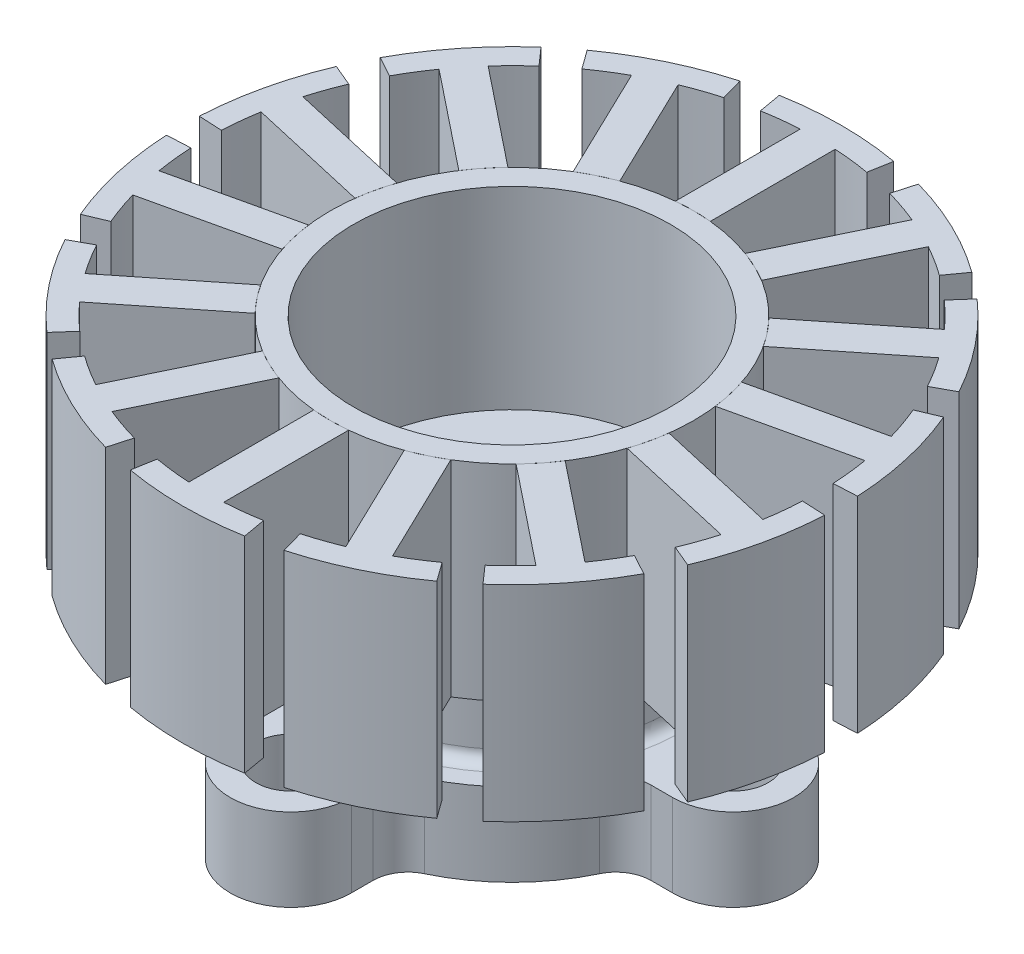
from build123d import *

# Parameters (mm, degrees)
SKETCH_1_R               = 1.5
SKETCH_1_R_2             = 6.25
EXTRUDE_1_DEPTH          = 3.55
FILLET_1_R               = 1.5
SKETCH_2_W               = 2
SKETCH_2_H               = 3.6
FILLET_2_R               = 0.5
SKETCH_4_W               = 1
SKETCH_4_H               = 8.82
EXTRUDE_2_DEPTH          = 8.82
PATTERN_CIRCULAR_1_COUNT = 14


with BuildPart() as part:
    # Эскиз1 → Бобышка-Вытянуть1 (new body)
    with BuildSketch(Plane(origin=(0, 0, 0), x_dir=(1, 0, 0), z_dir=(0, 1, 0))):
        with BuildLine():
            Line((-2.6, 9.5), (-2.6, 7.565712128))
            ThreePointArc((-2.6, 7.565712128), (-5.656854249, 5.656854249), (-7.565712128, 2.6))
            Line((-7.565712128, 2.6), (-9.5, 2.6))
            ThreePointArc((-9.5, 2.6), (-12.1, 0), (-9.5, -2.6))
            Line((-9.5, -2.6), (-7.565712128, -2.6))
            ThreePointArc((-7.565712128, -2.6), (-5.656854249, -5.656854249), (-2.6, -7.565712128))
            Line((-2.6, -7.565712128), (-2.6, -9.5))
            ThreePointArc((-2.6, -9.5), (0, -12.1), (2.6, -9.5))
            Line((2.6, -9.5), (2.6, -7.565712128))
            ThreePointArc((2.6, -7.565712128), (5.656854249, -5.656854249), (7.565712128, -2.6))
            Line((7.565712128, -2.6), (9.5, -2.6))
            ThreePointArc((9.5, -2.6), (12.1, 0), (9.5, 2.6))
            Line((9.5, 2.6), (7.565712128, 2.6))
            ThreePointArc((7.565712128, 2.6), (5.656854249, 5.656854249), (2.6, 7.565712128))
            Line((2.6, 7.565712128), (2.6, 9.5))
            ThreePointArc((2.6, 9.5), (0, 12.1), (-2.6, 9.5))
        make_face()
        with Locations(Location((0, 9.5, 0), (0, 0, 270))):
            Circle(SKETCH_1_R, mode=Mode.SUBTRACT)
        with Locations(Location((9.5, 0, 0), (0, 0, 270))):
            Circle(SKETCH_1_R, mode=Mode.SUBTRACT)
        with Locations(Location((-9.5, 0, 0), (0, 0, 270))):
            Circle(SKETCH_1_R, mode=Mode.SUBTRACT)
        with Locations(Location((0, -9.5, 0), (0, 0, 270))):
            Circle(SKETCH_1_R, mode=Mode.SUBTRACT)
        with Locations(Location((0, 0, 0), (0, 0, 270))):
            Circle(SKETCH_1_R_2, mode=Mode.SUBTRACT)
    extrude(amount=EXTRUDE_1_DEPTH)

    # Скругление1
    fillet_1_edges = [part.edges().sort_by_distance(p)[0] for p in [
        (2.6, 1.775, -7.565712128),
        (7.565712128, 1.775, -2.6),
        (7.565712128, 1.775, 2.6),
        (2.6, 1.775, 7.565712128),
        (-2.6, 1.775, 7.565712128),
        (-7.565712128, 1.775, 2.6),
        (-7.565712128, 1.775, -2.6),
        (-2.6, 1.775, -7.565712128),
    ]]
    fillet(fillet_1_edges, radius=FILLET_1_R)

    # Эскиз2 → Повернуть1 (revolve)
    with BuildSketch(Plane.XY, mode=Mode.PRIVATE) as revolve_1_sk:
        with Locations((-5.75, 5.35)):
            Rectangle(SKETCH_2_W, SKETCH_2_H)
    revolve(revolve_1_sk.sketch.rotate(Axis((0, 0, 0), (0, 1, 0)), 270), axis=Axis((0, 0, 0), (0, 1, 0)))

    # Скругление2
    fillet_2_edges = [part.edges().sort_by_distance(p)[0] for p in [
        (0, 3.55, 6.75),
    ]]
    fillet(fillet_2_edges, radius=FILLET_2_R)


with BuildPart() as body_2:
    # Эскиз4 → Повернуть2 (revolve)
    with BuildSketch(Plane.XY, mode=Mode.PRIVATE) as revolve_2_sk:
        with Locations((-7.30173618, 11.01)):
            Rectangle(SKETCH_4_W, SKETCH_4_H)
    revolve(revolve_2_sk.sketch.rotate(Axis((0, 0, 0), (0, 1, 0)), 270), axis=Axis((0, 0, 0), (0, 1, 0)))


with BuildPart() as body_3:
    # Эскиз5 → Бобышка-Вытянуть2 (new body)
    with BuildSketch(Plane(origin=(0, 15.42, 0), x_dir=(1, 0, 0), z_dir=(0, 1, 0))):
        with BuildLine():
            Line((0.75, 13.128594746), (0.75, 7.765602837))
            ThreePointArc((0.75, 7.765602837), (0, 7.80173618), (-0.75, 7.765602837))
            Line((-0.75, 7.765602837), (-0.75, 13.128594746))
            ThreePointArc((-0.75, 13.128594746), (-1.519356652, 13.061931533), (-2.283473536, 12.950221952))
            Line((-2.283473536, 12.950221952), (-2.457121714, 13.935029705))
            ThreePointArc((-2.457121714, 13.935029705), (0, 14.15), (2.457121714, 13.935029705))
            Line((2.457121714, 13.935029705), (2.283473536, 12.950221952))
            ThreePointArc((2.283473536, 12.950221952), (1.519356652, 13.061931533), (0.75, 13.128594746))
        make_face()
    extrude(amount=-EXTRUDE_2_DEPTH)


with BuildPart() as pattern_circular_1_1:
    # Круговой массив1: pattern copy
    add(body_3.part.rotate(Axis((0, 0, 0), (0, 1, 0)), 1 * 360 / PATTERN_CIRCULAR_1_COUNT))


with BuildPart() as pattern_circular_1_2:
    # Круговой массив1: pattern copy
    add(body_3.part.rotate(Axis((0, 0, 0), (0, 1, 0)), 2 * 360 / PATTERN_CIRCULAR_1_COUNT))


with BuildPart() as pattern_circular_1_3:
    # Круговой массив1: pattern copy
    add(body_3.part.rotate(Axis((0, 0, 0), (0, 1, 0)), 3 * 360 / PATTERN_CIRCULAR_1_COUNT))


with BuildPart() as pattern_circular_1_4:
    # Круговой массив1: pattern copy
    add(body_3.part.rotate(Axis((0, 0, 0), (0, 1, 0)), 4 * 360 / PATTERN_CIRCULAR_1_COUNT))


with BuildPart() as pattern_circular_1_5:
    # Круговой массив1: pattern copy
    add(body_3.part.rotate(Axis((0, 0, 0), (0, 1, 0)), 5 * 360 / PATTERN_CIRCULAR_1_COUNT))


with BuildPart() as pattern_circular_1_6:
    # Круговой массив1: pattern copy
    add(body_3.part.rotate(Axis((0, 0, 0), (0, 1, 0)), 6 * 360 / PATTERN_CIRCULAR_1_COUNT))


with BuildPart() as pattern_circular_1_7:
    # Круговой массив1: pattern copy
    add(body_3.part.rotate(Axis((0, 0, 0), (0, 1, 0)), 7 * 360 / PATTERN_CIRCULAR_1_COUNT))


with BuildPart() as pattern_circular_1_8:
    # Круговой массив1: pattern copy
    add(body_3.part.rotate(Axis((0, 0, 0), (0, 1, 0)), 8 * 360 / PATTERN_CIRCULAR_1_COUNT))


with BuildPart() as pattern_circular_1_9:
    # Круговой массив1: pattern copy
    add(body_3.part.rotate(Axis((0, 0, 0), (0, 1, 0)), 9 * 360 / PATTERN_CIRCULAR_1_COUNT))


with BuildPart() as pattern_circular_1_10:
    # Круговой массив1: pattern copy
    add(body_3.part.rotate(Axis((0, 0, 0), (0, 1, 0)), 10 * 360 / PATTERN_CIRCULAR_1_COUNT))


with BuildPart() as pattern_circular_1_11:
    # Круговой массив1: pattern copy
    add(body_3.part.rotate(Axis((0, 0, 0), (0, 1, 0)), 11 * 360 / PATTERN_CIRCULAR_1_COUNT))


with BuildPart() as pattern_circular_1_12:
    # Круговой массив1: pattern copy
    add(body_3.part.rotate(Axis((0, 0, 0), (0, 1, 0)), 12 * 360 / PATTERN_CIRCULAR_1_COUNT))


with BuildPart() as pattern_circular_1_13:
    # Круговой массив1: pattern copy
    add(body_3.part.rotate(Axis((0, 0, 0), (0, 1, 0)), 13 * 360 / PATTERN_CIRCULAR_1_COUNT))


solid = Compound([part.part, body_2.part, body_3.part, pattern_circular_1_1.part, pattern_circular_1_2.part, pattern_circular_1_3.part, pattern_circular_1_4.part, pattern_circular_1_5.part, pattern_circular_1_6.part, pattern_circular_1_7.part, pattern_circular_1_8.part, pattern_circular_1_9.part, pattern_circular_1_10.part, pattern_circular_1_11.part, pattern_circular_1_12.part, pattern_circular_1_13.part])
